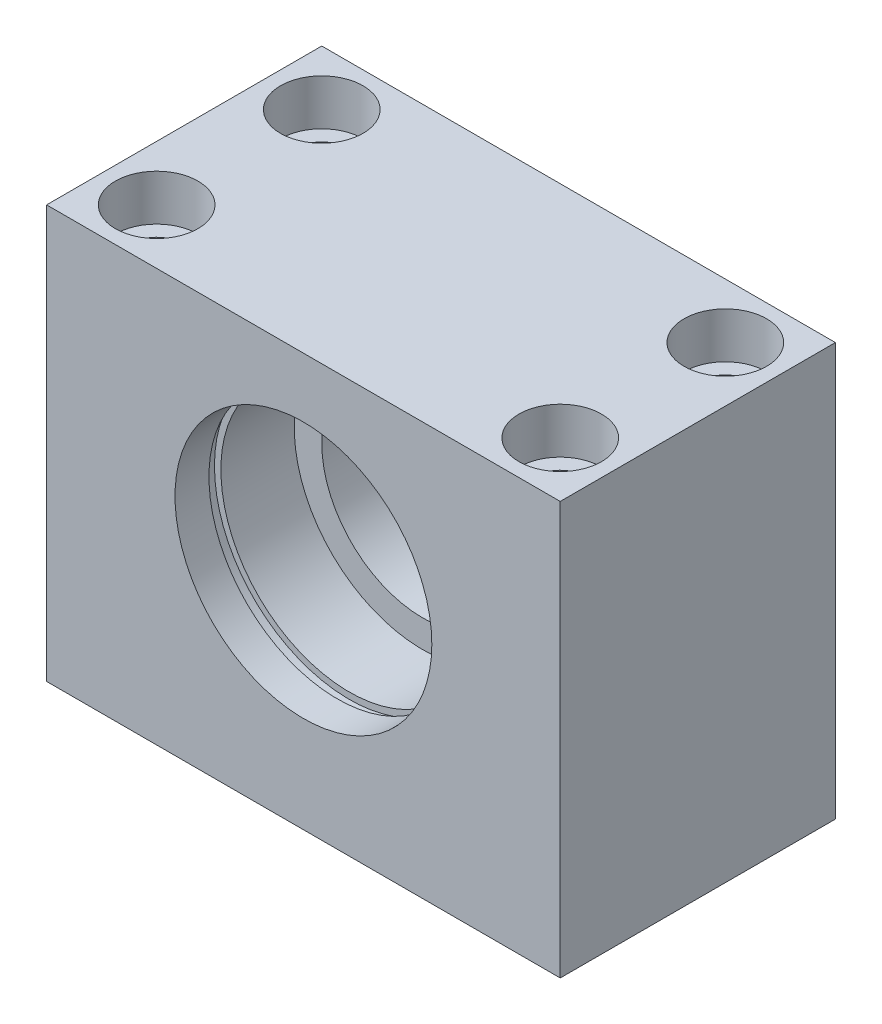
from build123d import *

# Parameters (mm, degrees)
SZKIC1_W                                             = 56
SZKIC1_H                                             = 30
DODANIE_WYCI_GNI_CIE1_DEPTH                          = 45
SZKIC3_R                                             = 11
WYTNIJ_WYCI_GNI_CIE2_DEPTH                           = 61.901559914
SZKIC4_R                                             = 14
WYTNIJ_WYCI_GNI_CIE3_DEPTH                           = 13
POG_BIENIE_WALCOWE_POD_M5_WKR_T_DO_CZ_CI_D           = 5.5
POG_BIENIE_WALCOWE_POD_M5_WKR_T_DO_CZ_CI_CBORE_D     = 9
POG_BIENIE_WALCOWE_POD_M5_WKR_T_DO_CZ_CI_CBORE_DEPTH = 5
SZKIC5_W                                             = 1.3
SZKIC5_H                                             = 0.7


with BuildPart() as part:
    # Szkic1 → Dodanie-wyciągnięcie1 (new body)
    with BuildSketch(Plane(origin=(0, 0, 0), x_dir=(1, 0, 0), z_dir=(0, 1, 0))):
        Rectangle(SZKIC1_W, SZKIC1_H)
    extrude(amount=DODANIE_WYCI_GNI_CIE1_DEPTH)

    # Szkic3 → Wytnij-wyciągnięcie2 (cut, through all)
    with BuildSketch(Plane.XY.offset(15)):
        with Locations((0, 24.5)):
            Circle(SZKIC3_R)
    extrude(amount=-WYTNIJ_WYCI_GNI_CIE2_DEPTH, mode=Mode.SUBTRACT)

    # Szkic4 → Wytnij-wyciągnięcie3 (cut)
    with BuildSketch(Plane.XY.offset(15)):
        with Locations((0, 24.5)):
            Circle(SZKIC4_R)
    extrude(amount=-WYTNIJ_WYCI_GNI_CIE3_DEPTH, mode=Mode.SUBTRACT)

    # Pogłębienie walcowe pod M5 Wkręt do części metalowych z łbem sześciokątnym1 (through all)
    with Locations(Plane(origin=(0, 45, 0), x_dir=(1, 0, 0), z_dir=(0, 1, 0))):
        with Locations((22, 9), (22, -9), (-22, -9), (-22, 9)):
            CounterBoreHole(POG_BIENIE_WALCOWE_POD_M5_WKR_T_DO_CZ_CI_D / 2, POG_BIENIE_WALCOWE_POD_M5_WKR_T_DO_CZ_CI_CBORE_D / 2, POG_BIENIE_WALCOWE_POD_M5_WKR_T_DO_CZ_CI_CBORE_DEPTH)

    # Szkic5 → Wycięcie-obrót1 (revolve, cut)
    with BuildSketch(Plane(origin=(0, 0, 0), x_dir=(0, 0, -1), z_dir=(1, 0, 0)), mode=Mode.PRIVATE) as wyci_cie_obr_t1_sk:
        with Locations((-10.65, 10.15)):
            Rectangle(SZKIC5_W, SZKIC5_H)
    revolve(wyci_cie_obr_t1_sk.sketch.rotate(Axis((0, 24.5, 9.294649117), (0, 0, 1)), 90), axis=Axis((0, 24.5, 9.294649117), (0, 0, 1)), mode=Mode.SUBTRACT)


solid = part.part
